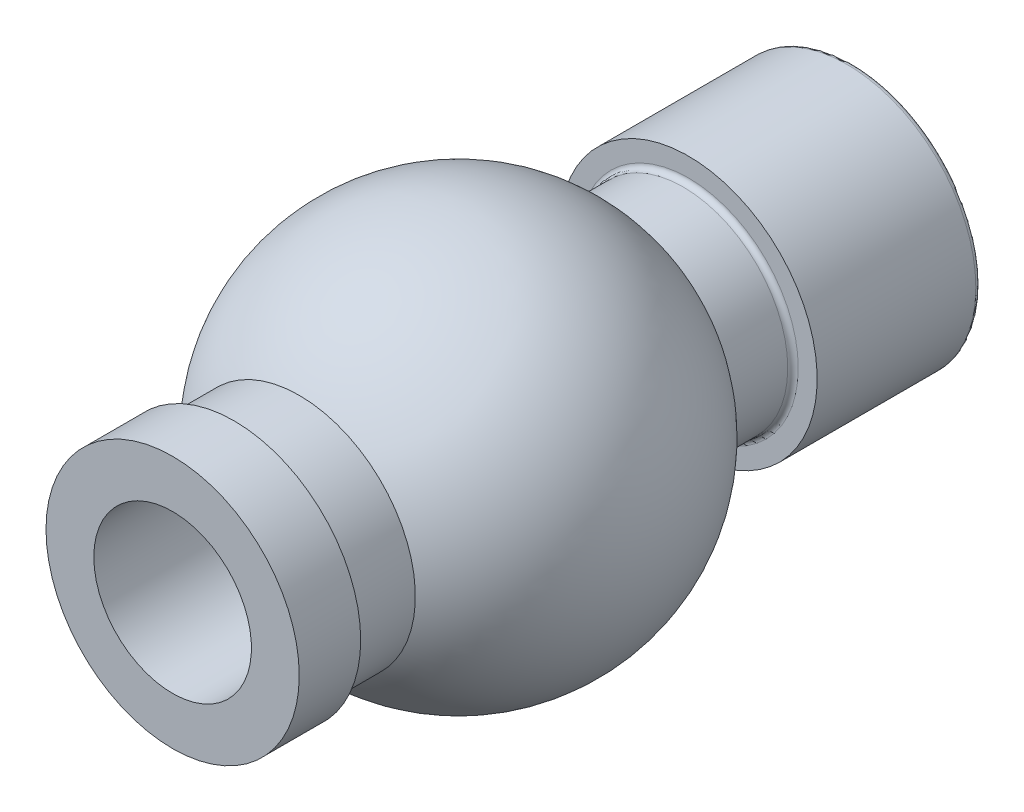
from build123d import *

# Parameters (mm, degrees)
SKETCH1_R           = 2.45
SKETCH1_R_2         = 1.5
BOSS_EXTRUDE1_DEPTH = 3.12
SKETCH2_R           = 1.99
SKETCH2_R_2         = 1.5
BOSS_EXTRUDE2_DEPTH = 1.2
FILLET1_R           = 0.1
CUT_EXTRUDE1_START  = -8.2
SKETCH5_R           = 1.5
CUT_EXTRUDE1_DEPTH  = 8.2
SKETCH6_R           = 2.21
SKETCH6_R_2         = 1.5
BOSS_EXTRUDE3_DEPTH = 1.24
SKETCH7_R           = 2.41
SKETCH7_R_2         = 1.5
BOSS_EXTRUDE4_DEPTH = 1.17


with BuildPart() as part:
    # Sketch1 → Boss-Extrude1 (new body)
    with BuildSketch(Plane.XY):
        with Locations(Location((0, 0, 0), (0, 0, 180))):
            Circle(SKETCH1_R)
        with Locations(Location((0, 0, 0), (0, 0, 180))):
            Circle(SKETCH1_R_2, mode=Mode.SUBTRACT)
    extrude(amount=BOSS_EXTRUDE1_DEPTH)

    # Sketch2 → Boss-Extrude2 (add)
    with BuildSketch(Plane.XY.offset(3.12)):
        Circle(SKETCH2_R)
        with Locations(Location((0, 0, 0), (0, 0, 180))):
            Circle(SKETCH2_R_2, mode=Mode.SUBTRACT)
    extrude(amount=BOSS_EXTRUDE2_DEPTH)

    # Fillet1
    fillet1_edges = [part.edges().sort_by_distance(p)[0] for p in [
        (-1.99, 0, 3.12),
        (2.45, 0, 0),
    ]]
    fillet(fillet1_edges, radius=FILLET1_R)

    # Sketch3 → Revolve1 (revolve)
    with BuildSketch(Plane(origin=(0, 0, 0), x_dir=(0, 0, -1), z_dir=(1, 0, 0))):
        with BuildLine():
            Line((-4.32, 0), (-4.32, 1.99))
            ThreePointArc((-4.32, 1.99), (-7.365617926, 3.747647485), (-10.528014715, 2.21))
            Line((-10.528014715, 2.21), (-10.528014715, 0))
            Line((-10.528014715, 0), (-4.32, 0))
        make_face()
    revolve(axis=Axis((0, 0, 4.32), (0, 0, 1)))

    # Sketch5 → Cut-Extrude1 (cut)
    with BuildSketch(Plane.XY.offset(10.528014715).offset(CUT_EXTRUDE1_START)):
        with Locations(Location((0, 0, 0), (0, 0, 180))):
            Circle(SKETCH5_R)
    extrude(amount=CUT_EXTRUDE1_DEPTH, mode=Mode.SUBTRACT)

    # Sketch6 → Boss-Extrude3 (add)
    with BuildSketch(Plane.XY.offset(10.528014715)):
        with Locations(Location((0, 0, 0), (0, 0, 90))):
            Circle(SKETCH6_R)
        with Locations(Location((0, 0, 0), (0, 0, 180))):
            Circle(SKETCH6_R_2, mode=Mode.SUBTRACT)
    extrude(amount=BOSS_EXTRUDE3_DEPTH)

    # Sketch7 → Boss-Extrude4 (add)
    with BuildSketch(Plane.XY.offset(11.768014715)):
        with Locations(Location((0, 0, 0), (0, 0, 180))):
            Circle(SKETCH7_R)
        with Locations(Location((0, 0, 0), (0, 0, 180))):
            Circle(SKETCH7_R_2, mode=Mode.SUBTRACT)
    extrude(amount=BOSS_EXTRUDE4_DEPTH)


solid = part.part
